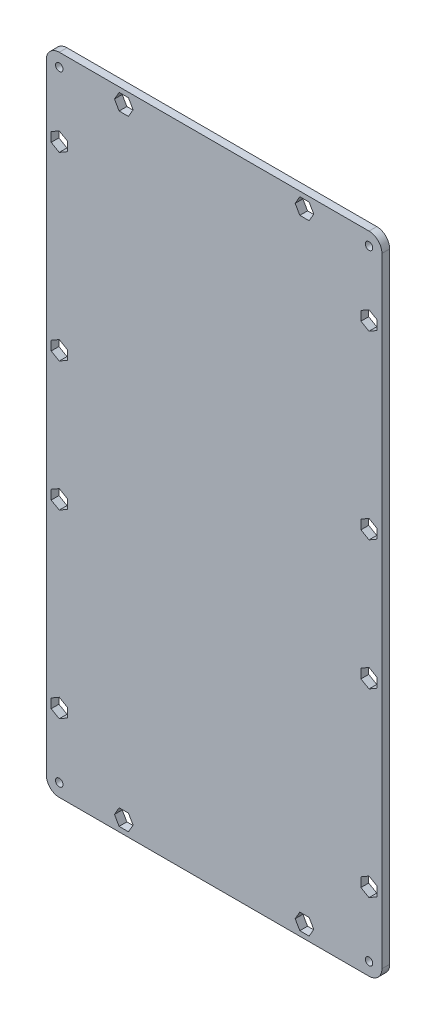
from build123d import *

# Parameters (mm, degrees)
BOSS_EXTRUDE1_DEPTH  = 3
SKETCH2_R            = 1.45
CUT_EXTRUDE1_DEPTH   = 141.921964221
CUT_EXTRUDE2_DEPTH   = 141.921964221
MIRROR2_COPY_1_DEPTH = 141.921964221


with BuildPart() as part:
    # Sketch1 → Boss-Extrude1 (new body)
    with BuildSketch(Plane.XY):
        with BuildLine():
            Line((-60, -125), (60, -125))
            ThreePointArc((60, -125), (63.535533906, -123.535533906), (65, -120))
            Line((65, -120), (65, 120))
            ThreePointArc((65, 120), (63.535533906, 123.535533906), (60, 125))
            Line((60, 125), (-60, 125))
            ThreePointArc((-60, 125), (-63.535533906, 123.535533906), (-65, 120))
            Line((-65, 120), (-65, -120))
            ThreePointArc((-65, -120), (-63.535533906, -123.535533906), (-60, -125))
        make_face()
    extrude(amount=BOSS_EXTRUDE1_DEPTH)

    # Sketch2 → Cut-Extrude1 (cut, through all)
    with BuildSketch(Plane.XY.offset(3)):
        with Locations((-60, 120)):
            Circle(SKETCH2_R)
        with Locations(Location((-60, -120, 0), (0, 0, 180))):
            Circle(SKETCH2_R)
        with Locations((60, -120)):
            Circle(SKETCH2_R)
        with Locations(Location((60, 120, 0), (0, 0, 180))):
            Circle(SKETCH2_R)
    extrude(amount=-CUT_EXTRUDE1_DEPTH, mode=Mode.SUBTRACT)

    # Sketch3 → Cut-Extrude2 (cut, through all)
    with BuildSketch(Plane.XY.offset(3)):
        Polygon((-33.195780409, 123.125), (-36.804219591, 123.125), (-38.608439182, 120), (-36.804219591, 116.875), (-33.195780409, 116.875), (-31.391560818, 120), align=None)
        Polygon((-56.875, 96.804219591), (-60, 98.608439182), (-63.125, 96.804219591), (-63.125, 93.195780409), (-60, 91.391560818), (-56.875, 93.195780409), align=None)
        Polygon((-56.875, 26.804219591), (-60, 28.608439182), (-63.125, 26.804219591), (-63.125, 23.195780409), (-60, 21.391560818), (-56.875, 23.195780409), align=None)
    cut_extrude2 = extrude(amount=-CUT_EXTRUDE2_DEPTH, mode=Mode.SUBTRACT)

    # Mirror1: Cut-Extrude2 across plane
    add(cut_extrude2.mirror(Plane(origin=(0, 0, 0), x_dir=(0, 0, 1), z_dir=(1, 0, 0))), mode=Mode.SUBTRACT)

    # Mirror2: Cut-Extrude2 across plane
    add(cut_extrude2.mirror(Plane.ZX), mode=Mode.SUBTRACT)

    # Mirror2 copy 1 sketch → Mirror2 copy 1 (cut, through all)
    with BuildSketch(Plane(origin=(0, 0, 3), x_dir=(-1, 0, 0), z_dir=(0, 0, 1))):
        Polygon((-33.195780409, 123.125), (-36.804219591, 123.125), (-38.608439182, 120), (-36.804219591, 116.875), (-33.195780409, 116.875), (-31.391560818, 120), align=None)
        Polygon((-56.875, 96.804219591), (-60, 98.608439182), (-63.125, 96.804219591), (-63.125, 93.195780409), (-60, 91.391560818), (-56.875, 93.195780409), align=None)
        Polygon((-56.875, 26.804219591), (-60, 28.608439182), (-63.125, 26.804219591), (-63.125, 23.195780409), (-60, 21.391560818), (-56.875, 23.195780409), align=None)
    extrude(amount=-MIRROR2_COPY_1_DEPTH, mode=Mode.SUBTRACT)


solid = part.part
